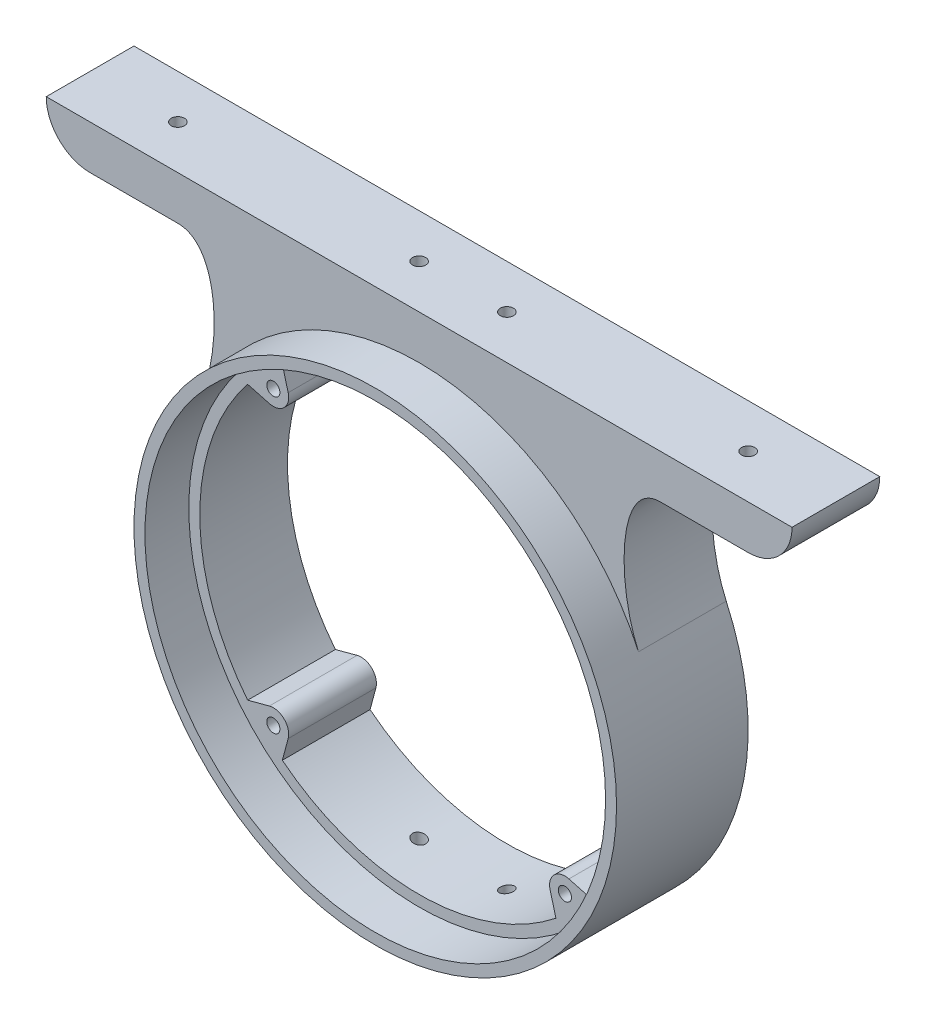
from build123d import *

# Parameters (mm, degrees)
SKETCH_2_R          = 50
EXTRUDE_1_DEPTH     = 20
SKETCH_3_R          = 1.5
CUT_EXTRUDE_1_DEPTH = 149.408220948
SKETCH_4_R          = 1.5
EXTRUDE_2_DEPTH     = 20
CUT_EXTRUDE_START   = -52
CUT_EXTRUDE_4_DEPTH = 57.857705442
CUT_EXTRUDE_5_DEPTH = 2
SKETCH_9_R          = 55
SKETCH_9_R_2        = 50
EXTRUDE_3_DEPTH     = 10
CUT_EXTRUDE_START_2 = -10
SKETCH_10_R         = 52.5
SKETCH_10_R_2       = 50
CUT_EXTRUDE_6_DEPTH = 10


with BuildPart() as part:
    # 草图2 → 凸台-拉伸1 (new body)
    with BuildSketch(Plane.XY):
        with BuildLine():
            Line((-75, 55), (-55, 55))
            add(Edge.make_bspline(
                [(-50, 22.912878475), (-45, 33.823772987), (-45, 55), (-55, 55)],
                knots=[0, 0, 0, 0, 1, 1, 1, 1], degree=3))
            ThreePointArc((-50, 22.912878475), (0, -55), (50, 22.912878475))
            add(Edge.make_bspline(
                [(50, 22.912878475), (45, 33.823772987), (45, 55), (55, 55)],
                knots=[0, 0, 0, 0, 1, 1, 1, 1], degree=3))
            Line((55, 55), (75, 55))
            ThreePointArc((75, 55), (82.071067812, 57.928932188), (85, 65))
            Line((85, 65), (-85, 65))
            ThreePointArc((-85, 65), (-82.071067812, 57.928932188), (-75, 55))
        make_face()
        Circle(SKETCH_2_R, mode=Mode.SUBTRACT)
    extrude(amount=EXTRUDE_1_DEPTH)

    # 草图3 → 切除-拉伸1 (cut, through all)
    with BuildSketch(Plane(origin=(0, 65, 0), x_dir=(1, 0, 0), z_dir=(0, 1, 0))):
        with Locations(Location((-65, -10, 0), (0, 0, 180))):
            Circle(SKETCH_3_R)
        with Locations(Location((-10, -10, 0), (0, 0, 180))):
            Circle(SKETCH_3_R)
        with Locations(Location((10, -10, 0), (0, 0, 180))):
            Circle(SKETCH_3_R)
        with Locations(Location((65, -10, 0), (0, 0, 270))):
            Circle(SKETCH_3_R)
    extrude(amount=-CUT_EXTRUDE_1_DEPTH, mode=Mode.SUBTRACT)

    # 草图4 → 凸台-拉伸2 (add, through all)
    # profile 1 of 4: a face of its own
    with BuildSketch(Plane.XY):
        with BuildLine():
            Line((-31.179095181, 39.087901245), (-29.853278324, 34.139885374))
            ThreePointArc((-29.853278324, 34.139885374), (-30.759144982, 30.759144982), (-34.139885374, 29.853278324))
            Line((-34.139885374, 29.853278324), (-39.087901245, 31.179095181))
            ThreePointArc((-39.087901245, 31.179095181), (-35.355339059, 35.355339059), (-31.179095181, 39.087901245))
        make_face()
        with Locations((-33.234018716, 33.234018716)):
            Circle(SKETCH_4_R, mode=Mode.SUBTRACT)
    # profile 2 of 4: a face of its own
    with BuildSketch(Plane.XY):
        with BuildLine():
            Line((31.179095181, 39.087901245), (29.853278324, 34.139885374))
            ThreePointArc((29.853278324, 34.139885374), (30.759144982, 30.759144982), (34.139885374, 29.853278324))
            Line((34.139885374, 29.853278324), (39.087901245, 31.179095181))
            ThreePointArc((39.087901245, 31.179095181), (35.355339059, 35.355339059), (31.179095181, 39.087901245))
        make_face()
        with Locations((33.234018716, 33.234018716)):
            Circle(SKETCH_4_R, mode=Mode.SUBTRACT)
    # profile 3 of 4: a face of its own
    with BuildSketch(Plane.XY):
        with BuildLine():
            Line((39.087901245, -31.179095181), (34.139885374, -29.853278324))
            ThreePointArc((34.139885374, -29.853278324), (30.759144982, -30.759144982), (29.853278324, -34.139885374))
            Line((29.853278324, -34.139885374), (31.179095181, -39.087901245))
            ThreePointArc((31.179095181, -39.087901245), (35.355339059, -35.355339059), (39.087901245, -31.179095181))
        make_face()
        with Locations((33.234018716, -33.234018716)):
            Circle(SKETCH_4_R, mode=Mode.SUBTRACT)
    # profile 4 of 4: a face of its own
    with BuildSketch(Plane.XY):
        with BuildLine():
            Line((-31.179095181, -39.087901245), (-29.853278324, -34.139885374))
            ThreePointArc((-29.853278324, -34.139885374), (-30.759144982, -30.759144982), (-34.139885374, -29.853278324))
            Line((-34.139885374, -29.853278324), (-39.087901245, -31.179095181))
            ThreePointArc((-39.087901245, -31.179095181), (-35.355339059, -35.355339059), (-31.179095181, -39.087901245))
        make_face()
        with Locations((-33.234018716, -33.234018716)):
            Circle(SKETCH_4_R, mode=Mode.SUBTRACT)
    extrude(amount=EXTRUDE_2_DEPTH)

    # 草图6 → 切除-拉伸4 (cut, through all)
    with BuildSketch(Plane(origin=(0, 0, 0), x_dir=(1, 0, 0), z_dir=(0, 1, 0)).offset(CUT_EXTRUDE_START)):
        Polygon((-8.41228676, -7.25), (-11.58771324, -7.25), (-13.175426481, -10), (-11.58771324, -12.75), (-8.41228676, -12.75), (-6.824573519, -10), align=None)
        Polygon((6.824573519, -10), (8.41228676, -7.25), (11.58771324, -7.25), (13.175426481, -10), (11.58771324, -12.75), (8.41228676, -12.75), align=None)
    extrude(amount=-CUT_EXTRUDE_4_DEPTH, mode=Mode.SUBTRACT)

    # 草图7 → 切除-拉伸5 (cut)
    with BuildSketch(Plane.XZ.offset(-55)):
        Polygon((-63.41228676, 12.75), (-66.58771324, 12.75), (-68.175426481, 10), (-66.58771324, 7.25), (-63.41228676, 7.25), (-61.824573519, 10), align=None)
        Polygon((61.824573519, 10), (63.41228676, 12.75), (66.58771324, 12.75), (68.175426481, 10), (66.58771324, 7.25), (63.41228676, 7.25), align=None)
    extrude(amount=-CUT_EXTRUDE_5_DEPTH, mode=Mode.SUBTRACT)

    # 草图9 → 凸台-拉伸3 (add)
    with BuildSketch(Plane.XY.offset(20)):
        with Locations(Location((0, 0, 0), (0, 0, 155.380022671))):
            Circle(SKETCH_9_R)
        with Locations(Location((0, 0, 0), (0, 0, 218.578178478))):
            Circle(SKETCH_9_R_2, mode=Mode.SUBTRACT)
    extrude(amount=EXTRUDE_3_DEPTH)

    # 草图10 → 切除-拉伸6 (cut)
    with BuildSketch(Plane.XY.offset(30).offset(CUT_EXTRUDE_START_2)):
        Circle(SKETCH_10_R)
        Circle(SKETCH_10_R_2, mode=Mode.SUBTRACT)
    extrude(amount=CUT_EXTRUDE_6_DEPTH, mode=Mode.SUBTRACT)


solid = part.part
